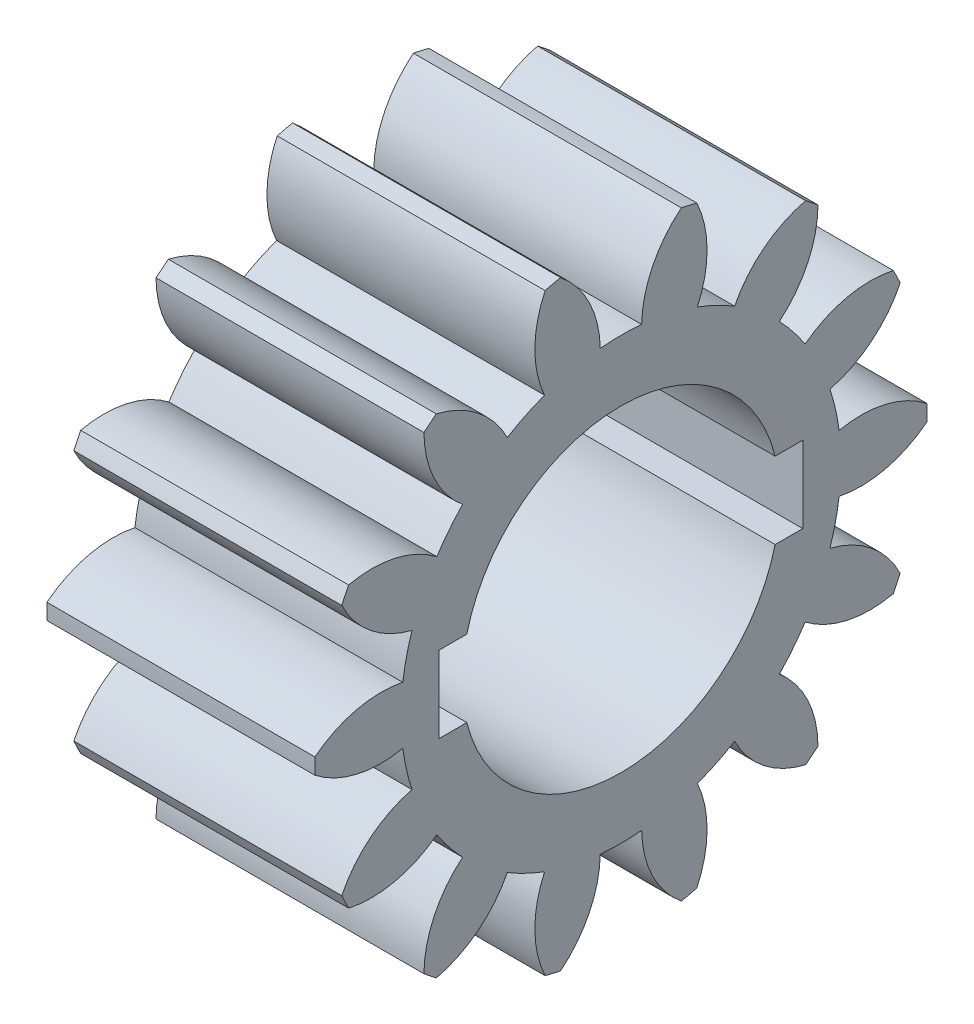
from build123d import *

# Parameters (mm, degrees)
BASPROSKE_W        = 7
BASPROSKE_H        = 8
TOOTHCUT_DEPTH     = 14.304134696
TEETHCUTS_COUNT    = 14
TEETHCUTS_ANGLE    = 334.285714286
BORSKE_R           = 2.5
BORE_DEPTH         = 50.0000508
CUT_EXTRUDE2_DEPTH = 10
SKETCH2_R          = 4.15
CUT_EXTRUDE3_DEPTH = 14.210255756


with BuildPart() as part:
    # BasProSke → Base-Revolve (revolve)
    with BuildSketch(Plane(origin=(0, 0, 0), x_dir=(1, 0, 0), z_dir=(0, 1, 0)), mode=Mode.PRIVATE) as base_revolve_sk:
        with Locations((3.5, 4)):
            Rectangle(BASPROSKE_W, BASPROSKE_H)
    revolve(base_revolve_sk.sketch.rotate(Axis((-10, 0, 0), (1, 0, 0)), 180), axis=Axis((-10, 0, 0), (1, 0, 0)))

    # TooCutSke → ToothCut (cut, through all)
    with BuildSketch(Plane(origin=(0, 0, 0), x_dir=(0, 0, -1), z_dir=(1, 0, 0))):
        with BuildLine():
            ThreePointArc((0.540393256, 5.723545765), (0, 5.749), (-0.540393256, 5.723545765))
            ThreePointArc((-0.540393256, 5.723545765), (-0.832220085, 6.912663993), (-1.603550271, 7.863566092))
            ThreePointArc((-1.603550271, 7.863566092), (0, 8.0254), (1.603550271, 7.863566092))
            ThreePointArc((1.603550271, 7.863566092), (0.832220085, 6.912663993), (0.540393256, 5.723545765))
        make_face()
    toothcut = extrude(amount=TOOTHCUT_DEPTH, mode=Mode.SUBTRACT)

    # TeethCuts: ToothCut ×14 about axis
    teethcuts_axis = Axis((-10, 0, 0), (1, 0, 0))
    for i in range(1, TEETHCUTS_COUNT):
        add(toothcut.rotate(teethcuts_axis, i * TEETHCUTS_ANGLE / (TEETHCUTS_COUNT - 1)), mode=Mode.SUBTRACT)

    # BorSke → Bore (cut, symmetric)
    with BuildSketch(Plane(origin=(0, 0, 0), x_dir=(0, 0, -1), z_dir=(1, 0, 0))):
        with Locations(Location((0, 0, 0), (0, 0, 180))):
            Circle(BORSKE_R)
    extrude(amount=BORE_DEPTH, both=True, mode=Mode.SUBTRACT)

    # Sketch1 → Cut-Extrude2 (cut)
    with BuildSketch(Plane(origin=(7, 0, 0), x_dir=(0, 0, -1), z_dir=(1, 0, 0))):
        with BuildLine():
            Line((3.872983346, 1), (4.75, 1))
            Line((4.75, 1), (4.75, -1))
            Line((4.75, -1), (3.872983346, -1))
            ThreePointArc((3.872983346, -1), (0, -4), (-3.872983346, -1))
            Line((-3.872983346, -1), (-4.75, -1))
            Line((-4.75, -1), (-4.75, 1))
            Line((-4.75, 1), (-3.872983346, 1))
            ThreePointArc((-3.872983346, 1), (0, 4), (3.872983346, 1))
        make_face()
    extrude(amount=-CUT_EXTRUDE2_DEPTH, mode=Mode.SUBTRACT)

    # Sketch2 → Cut-Extrude3 (cut, through all)
    with BuildSketch(Plane(origin=(7, 0, 0), x_dir=(0, 0, -1), z_dir=(1, 0, 0))):
        Circle(SKETCH2_R)
    extrude(amount=-CUT_EXTRUDE3_DEPTH, mode=Mode.SUBTRACT)


solid = part.part
